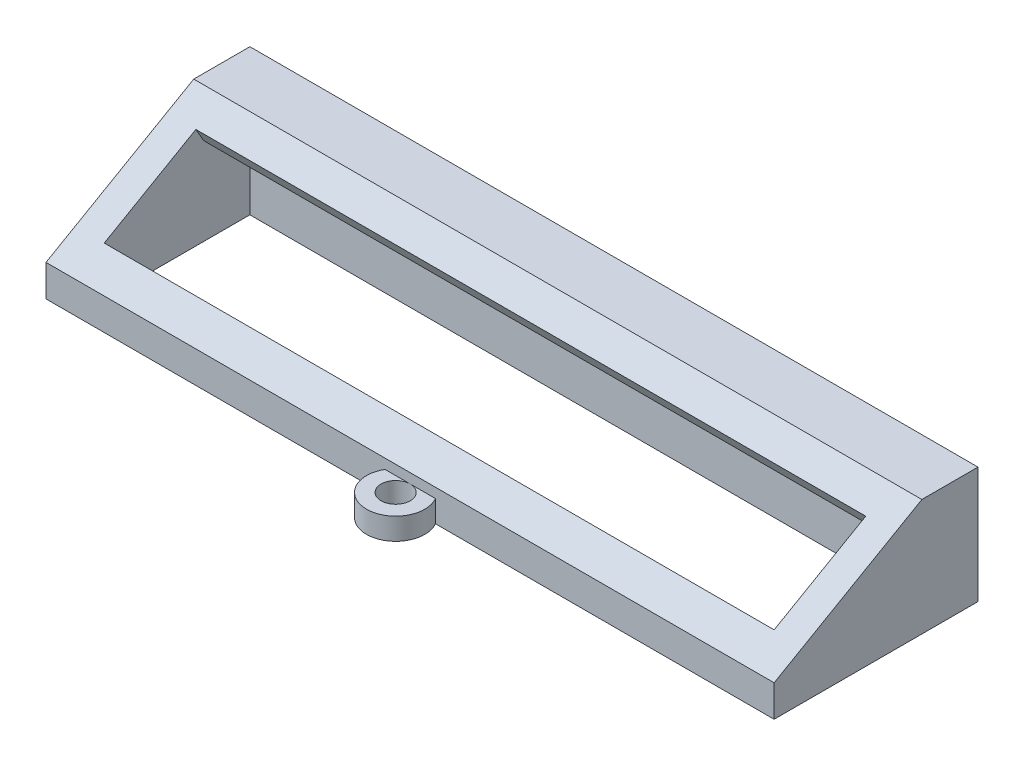
from build123d import *

# Parameters (mm, degrees)
SKETCH_1_W          = 500
SKETCH_1_H          = 140
EXTRUDE_1_DEPTH     = 80
SKETCH_2_W          = 460
SKETCH_2_H          = 100
CUT_EXTRUDE_1_DEPTH = 60
SKETCH_6_R          = 20
SKETCH_6_R_2        = 10
EXTRUDE_4_DEPTH     = 15
CUT_EXTRUDE_2_DEPTH = 517.139516023
SKETCH_8_W          = 460
SKETCH_8_H          = 18.765324385
CUT_EXTRUDE_3_DEPTH = 15


with BuildPart() as part:
    # 草圖1 → 填料-伸長1 (new body)
    with BuildSketch(Plane(origin=(0, 0, 0), x_dir=(1, 0, 0), z_dir=(0, 1, 0))):
        Rectangle(SKETCH_1_W, SKETCH_1_H)
    extrude(amount=EXTRUDE_1_DEPTH)

    # 草圖2 → 除料-伸長1 (cut)
    with BuildSketch(Plane.XZ):
        Rectangle(SKETCH_2_W, SKETCH_2_H)
    extrude(amount=-CUT_EXTRUDE_1_DEPTH, mode=Mode.SUBTRACT)

    # 草圖6 → 伸長-薄件4 (add)
    with BuildSketch(Plane.XZ):
        with Locations((0.114006629, 80)):
            Circle(SKETCH_6_R)
        with Locations((0.114006629, 80)):
            Circle(SKETCH_6_R_2, mode=Mode.SUBTRACT)
    extrude(amount=-EXTRUDE_4_DEPTH)

    # 草圖7 → 除料-伸長2 (cut, through all)
    with BuildSketch(Plane(origin=(250, 0, 0), x_dir=(0, 0, -1), z_dir=(1, 0, 0))):
        Polygon((-70, 21.729405289), (31.457073642, 80), (-70, 80), align=None)
    extrude(amount=-CUT_EXTRUDE_2_DEPTH, mode=Mode.SUBTRACT)

    # 草圖8 → 除料-伸長3 (cut)
    with BuildSketch(Plane(origin=(0, 46.570964705, 26.747448081), x_dir=(1, 0, 0), z_dir=(0, 0.8671544755717103, 0.4980392710378893))):
        with Locations((0, 36.346470221)):
            Rectangle(SKETCH_8_W, SKETCH_8_H)
    extrude(amount=-CUT_EXTRUDE_3_DEPTH, mode=Mode.SUBTRACT)


solid = part.part
